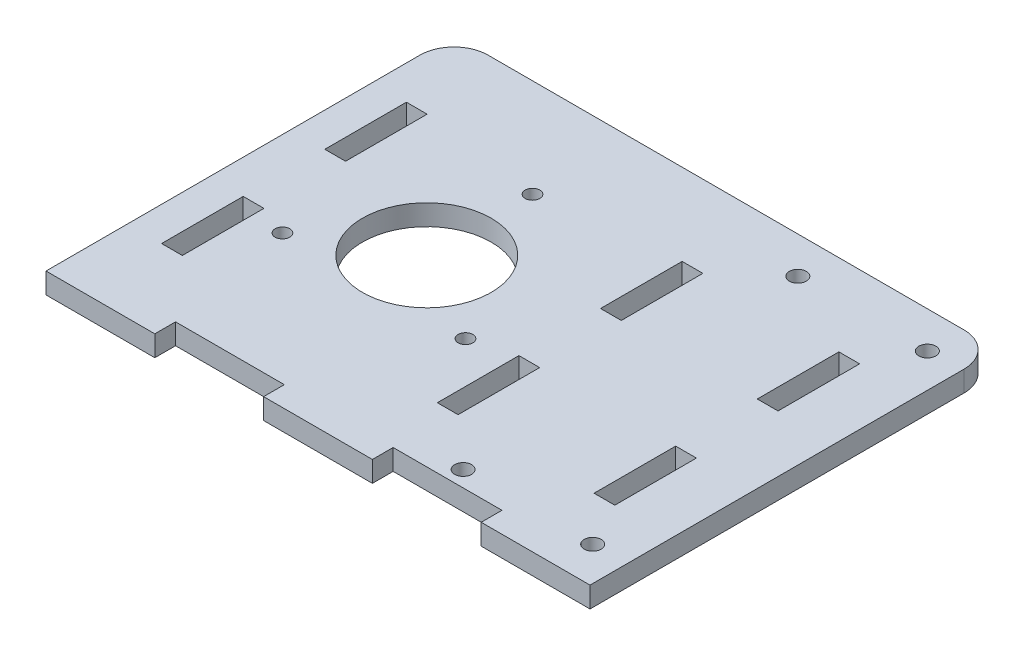
from build123d import *

# Parameters (mm, degrees)
SKETCH1_R           = 18.93
SKETCH1_R_2         = 2.159
SKETCH1_R_3         = 2.5
SKETCH1_W           = 6.1
SKETCH1_H           = 24
BOSS_EXTRUDE1_DEPTH = 6.096


with BuildPart() as part:
    # Sketch1 → Boss-Extrude1 (new body)
    with BuildSketch(Plane(origin=(0, 0, 0), x_dir=(1, 0, 0), z_dir=(0, 1, 0))):
        with BuildLine():
            Line((-150, 120), (-10, 120))
            ThreePointArc((-10, 120), (-2.928932188, 117.071067812), (0, 110))
            Line((0, 110), (0, 0))
            Line((0, 0), (-32, 0))
            Line((-32, 0), (-32, 6.1))
            Line((-32, 6.1), (-64, 6.1))
            Line((-64, 6.1), (-64, 0))
            Line((-64, 0), (-96, 0))
            Line((-96, 0), (-96, 6.1))
            Line((-96, 6.1), (-128, 6.1))
            Line((-128, 6.1), (-128, 0))
            Line((-128, 0), (-160, 0))
            Line((-160, 0), (-160, 110))
            ThreePointArc((-160, 110), (-157.071067812, 117.071067812), (-150, 120))
        make_face()
        with Locations(Location((-108, 60, 0), (0, 0, 90))):
            Circle(SKETCH1_R, mode=Mode.SUBTRACT)
        with Locations(Location((-108, 91.089, 0), (0, 0, 90))):
            Circle(SKETCH1_R_2, mode=Mode.SUBTRACT)
        with Locations(Location((-81.076136222, 44.4555, 0), (0, 0, 90))):
            Circle(SKETCH1_R_2, mode=Mode.SUBTRACT)
        with Locations(Location((-134.923863778, 44.4555, 0), (0, 0, 90))):
            Circle(SKETCH1_R_2, mode=Mode.SUBTRACT)
        with Locations(Location((-48.1, 109.215, 0), (0, 0, 90))):
            Circle(SKETCH1_R_3, mode=Mode.SUBTRACT)
        with Locations(Location((-48.1, 10.785, 0), (0, 0, 90))):
            Circle(SKETCH1_R_3, mode=Mode.SUBTRACT)
        with Locations(Location((-10, 10.785, 0), (0, 0, 90))):
            Circle(SKETCH1_R_3, mode=Mode.SUBTRACT)
        with Locations(Location((-10, 109.215, 0), (0, 0, 90))):
            Circle(SKETCH1_R_3, mode=Mode.SUBTRACT)
        with Locations((-146.95, 84)):
            Rectangle(SKETCH1_W, SKETCH1_H, mode=Mode.SUBTRACT)
        with Locations((-146.95, 36)):
            Rectangle(SKETCH1_W, SKETCH1_H, mode=Mode.SUBTRACT)
        with Locations((-65.85, 84)):
            Rectangle(SKETCH1_W, SKETCH1_H, mode=Mode.SUBTRACT)
        with Locations((-65.85, 36)):
            Rectangle(SKETCH1_W, SKETCH1_H, mode=Mode.SUBTRACT)
        with Locations((-19.75, 36)):
            Rectangle(SKETCH1_W, SKETCH1_H, mode=Mode.SUBTRACT)
        with Locations((-19.75, 84)):
            Rectangle(SKETCH1_W, SKETCH1_H, mode=Mode.SUBTRACT)
    extrude(amount=BOSS_EXTRUDE1_DEPTH)


solid = part.part
